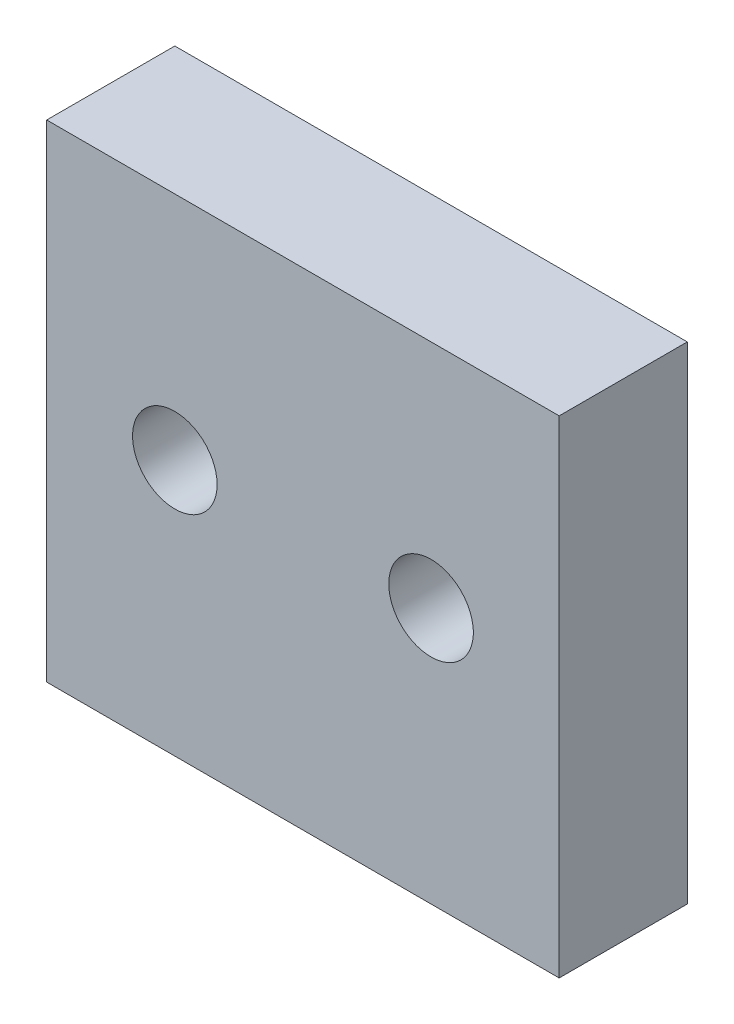
from build123d import *

# Parameters (mm, degrees)
SKETCH_1_W          = 20
SKETCH_1_H          = 20
SKETCH_1_R          = 1.65
EXTRUDE_1_DEPTH     = 5
SKETCH_2_W          = 20
SKETCH_2_H          = 1
CUT_EXTRUDE_1_DEPTH = 5


with BuildPart() as part:
    # 草图1 → 凸台-拉伸1 (new body)
    with BuildSketch(Plane.XY):
        Rectangle(SKETCH_1_W, SKETCH_1_H)
        with Locations((-5, 0)):
            Circle(SKETCH_1_R, mode=Mode.SUBTRACT)
        with Locations(Location((5, 0, 0), (0, 0, 180))):
            Circle(SKETCH_1_R, mode=Mode.SUBTRACT)
    extrude(amount=EXTRUDE_1_DEPTH)

    # 草图2 → 切除-拉伸1 (cut)
    with BuildSketch(Plane.XY.offset(5)):
        with Locations((0, 9.5)):
            Rectangle(SKETCH_2_W, SKETCH_2_H)
    extrude(amount=-CUT_EXTRUDE_1_DEPTH, mode=Mode.SUBTRACT)


solid = part.part
